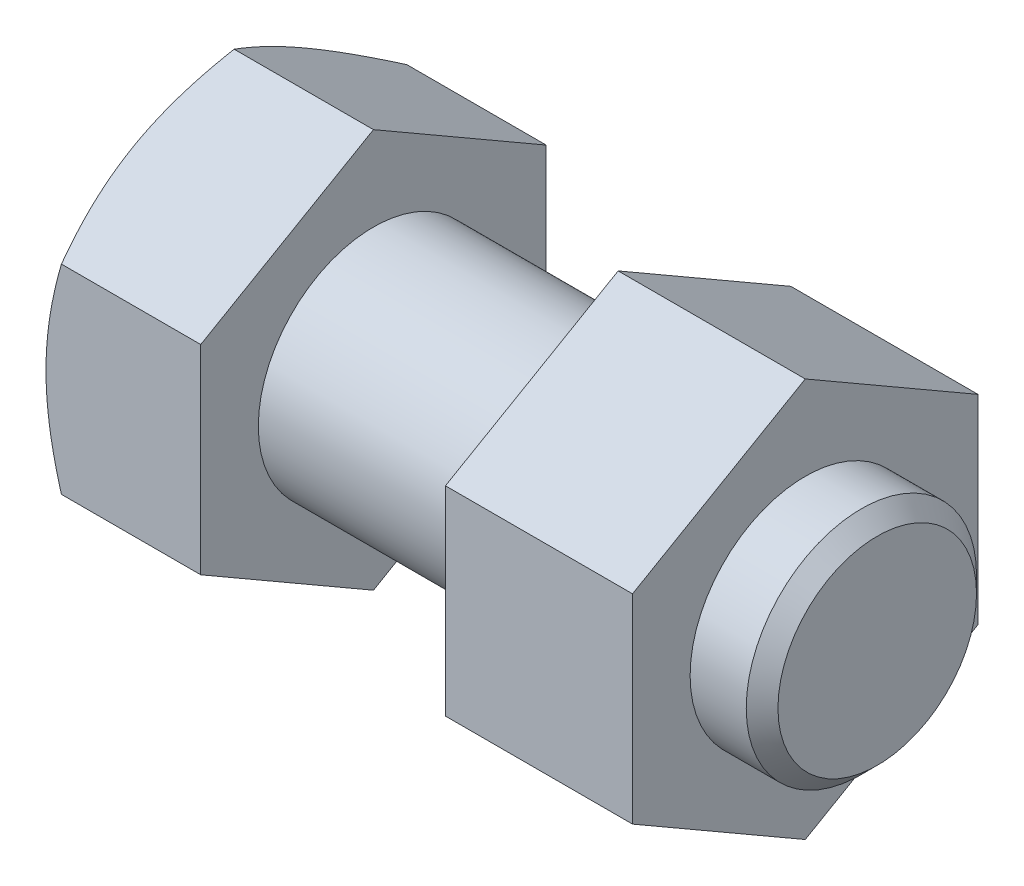
from build123d import *

# Parameters (mm, degrees)
BASEHEAD_DEPTH      = 10.75
BOSS_EXTRUDE1_DEPTH = 13


with BuildPart() as part:
    # Sketch1 → BaseHead (new body)
    with BuildSketch(Plane(origin=(0, 0, 0), x_dir=(0, 0, -1), z_dir=(1, 0, 0))):
        Polygon((12, 6.92820323), (12, -6.92820323), (0, -13.856406461), (-12, -6.92820323), (-12, 6.92820323), (0, 13.856406461), align=None)
    extrude(amount=BASEHEAD_DEPTH)

    # BodySke → BaseBody (revolve)
    with BuildSketch(Plane.XY, mode=Mode.PRIVATE) as basebody_sk:
        Polygon((0, 0), (45.75, 0), (45.75, 6.8985), (44.6485, 8), (0, 8), align=None)
    revolve(basebody_sk.sketch.rotate(Axis((0, 0, 0), (1, 0, 0)), 90), axis=Axis((0, 0, 0), (1, 0, 0)))

    # Sketch3 → HeadChamfer (revolve, cut)
    with BuildSketch(Plane.XY):
        Polygon((0, 12), (3.958548116, 18.856406461), (3.958548116, 23.856406461), (-10, 23.856406461), (-10, 12), align=None)
    revolve(axis=Axis((0, 0, 0), (1, 0, 0)), mode=Mode.SUBTRACT)


with BuildPart() as body_2:
    # Sketch4 → Boss-Extrude1 (new body)
    with BuildSketch(Plane(origin=(40.75, 0, 0), x_dir=(0, 0, -1), z_dir=(1, 0, 0))):
        Polygon((0, 13.856406461), (-12, 6.92820323), (-12, -6.92820323), (0, -13.856406461), (12, -6.92820323), (12, 6.92820323), align=None)
    extrude(amount=-BOSS_EXTRUDE1_DEPTH)


solid = Compound([part.part, body_2.part])
